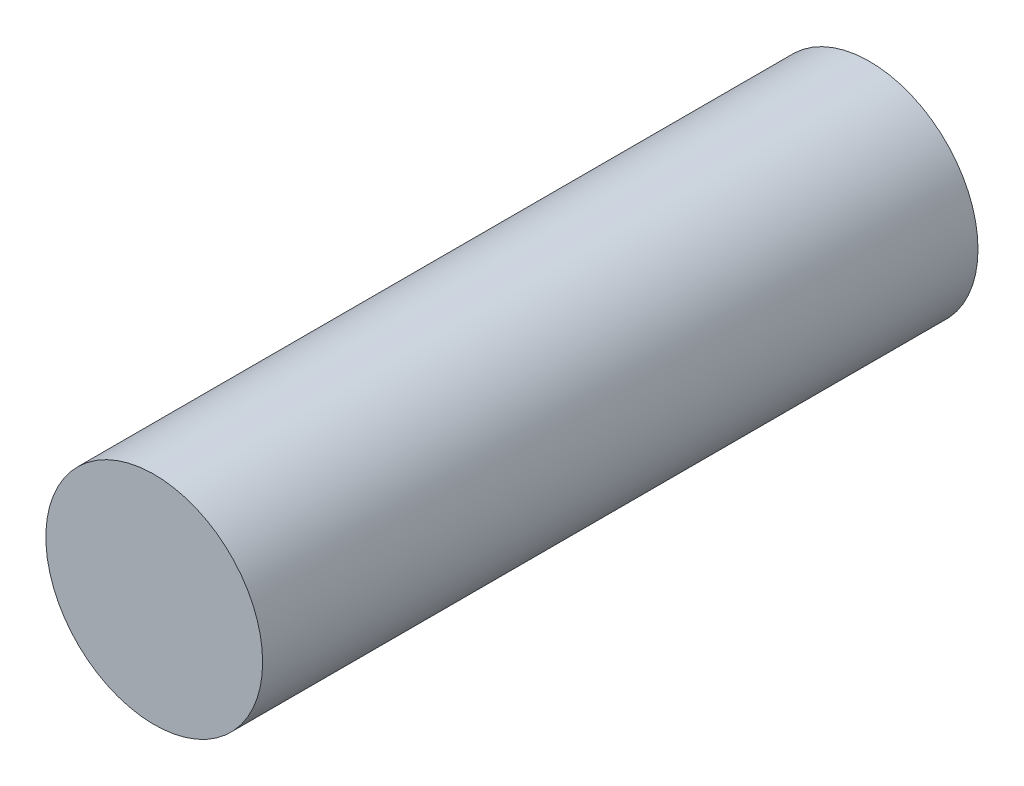
from build123d import *

# Parameters (mm, degrees)
SKETCH2_R           = 6.35
BOSS_EXTRUDE1_DEPTH = 41.91


with BuildPart() as part:
    # Sketch2 → Boss-Extrude1 (new body)
    with BuildSketch(Plane.XY):
        Circle(SKETCH2_R)
    extrude(amount=BOSS_EXTRUDE1_DEPTH)


solid = part.part
